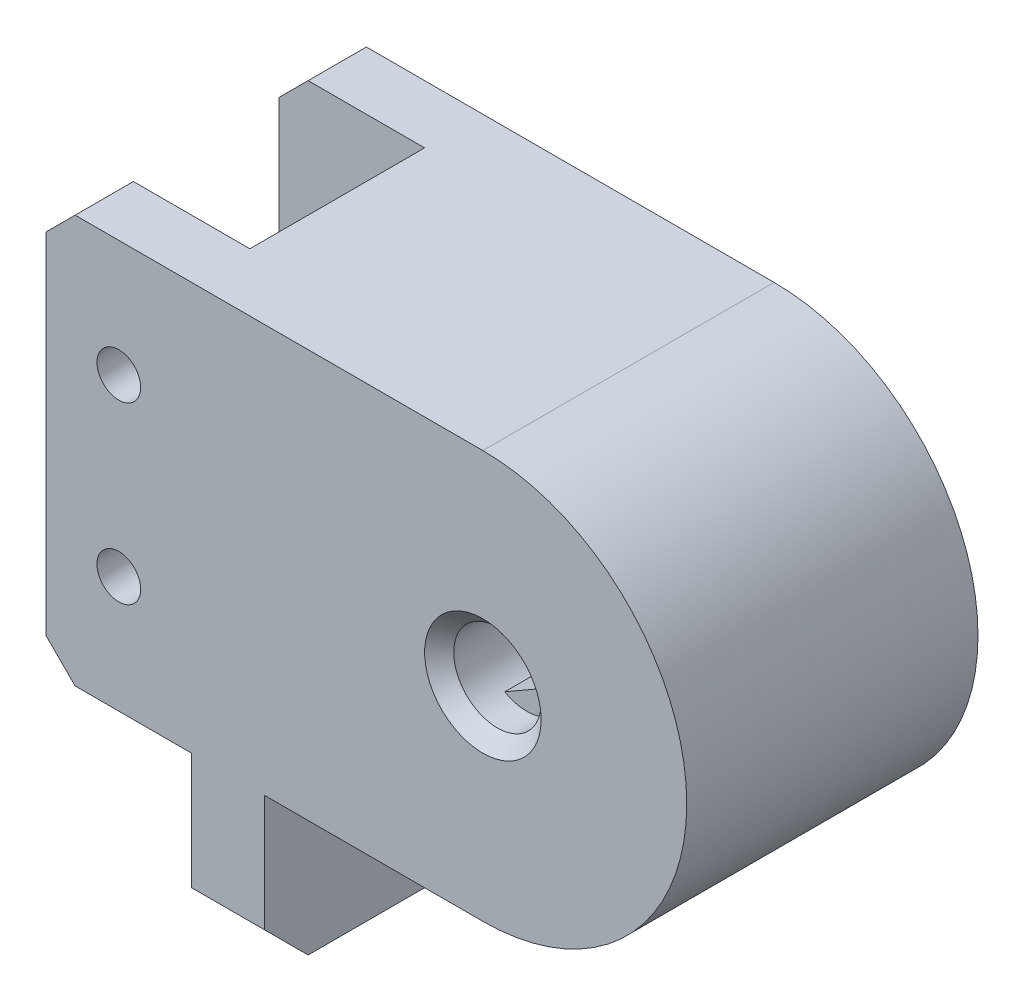
from build123d import *

# Parameters (mm, degrees)
EXTRUDE_1_DEPTH       = 20
CUT_EXTRUDE_1_DEPTH   = 39.678159
SKETCH_5_R            = 3
CUT_EXTRUDE_2_DEPTH   = 3
SKETCH_6_W            = 10
SKETCH_6_H            = 12
CUT_EXTRUDE_3_DEPTH   = 46.650849
F_3_0MM_1_D           = 3
F_3_0MM_1_CSINK_D     = 3.05
F_3_0MM_1_CSINK_ANGLE = 90
CHAMFER_2_SIZE        = 2
CUT_EXTRUDE_START     = -3
SKETCH_9_R            = 3
CUT_EXTRUDE_5_DEPTH   = 3
SKETCH_10_W           = 5
SKETCH_10_H           = 20
EXTRUDE_2_DEPTH       = 11
CHAMFER_3_SIZE        = 3
CHAMFER_4_SIZE        = 1


with BuildPart() as part:
    # 草图1 → 凸台-拉伸1 (new body)
    with BuildSketch(Plane.XY):
        with BuildLine():
            Line((0, 14), (-30, 14))
            Line((-30, 14), (-30, -14))
            Line((-30, -14), (0, -14))
            ThreePointArc((0, -14), (14, 0), (0, 14))
        make_face()
    extrude(amount=EXTRUDE_1_DEPTH)

    # 草图3 → 切除-拉伸1 (cut, through all)
    with BuildSketch(Plane(origin=(0, 0, 0), x_dir=(-1, 0, 0), z_dir=(0, 0, -1))):
        with BuildLine():
            Line((-3, 0), (1.5, -2.598076))
            ThreePointArc((1.5, -2.598076), (1.5, 2.598076), (-3, 0))
        make_face()
    extrude(amount=-CUT_EXTRUDE_1_DEPTH, mode=Mode.SUBTRACT)

    # 草图5 → 切除-拉伸2 (cut)
    with BuildSketch(Plane(origin=(0, 0, 0), x_dir=(-1, 0, 0), z_dir=(0, 0, -1))):
        Circle(SKETCH_5_R)
    extrude(amount=-CUT_EXTRUDE_2_DEPTH, mode=Mode.SUBTRACT)

    # 草图6 → 切除-拉伸3 (cut, through all)
    with BuildSketch(Plane.XZ.offset(14)):
        with Locations((-25, 10)):
            Rectangle(SKETCH_6_W, SKETCH_6_H)
    extrude(amount=-CUT_EXTRUDE_3_DEPTH, mode=Mode.SUBTRACT)

    # Ø3.0mm 暗销孔1 (through all)
    with Locations(Plane(origin=(-25, 6, 0), x_dir=(-1, 0, 0), z_dir=(0, 0, -1))):
        with Locations((0, 0), (0, -12)):
            CounterSinkHole(F_3_0MM_1_D / 2, F_3_0MM_1_CSINK_D / 2, counter_sink_angle=F_3_0MM_1_CSINK_ANGLE)

    # 倒角2
    chamfer_2_edges = [part.edges().sort_by_distance(p)[0] for p in [
        (-30, -14, 2),
        (-30, 14, 2),
        (-30, -14, 18),
        (-30, 14, 18),
    ]]
    chamfer(chamfer_2_edges, length=CHAMFER_2_SIZE)

    # 草图9 → 切除-拉伸5 (cut)
    with BuildSketch(Plane.XY.offset(20).offset(CUT_EXTRUDE_START)):
        with Locations(Location((0, 0, 0), (0, 0, 180))):
            Circle(SKETCH_9_R)
    extrude(amount=CUT_EXTRUDE_5_DEPTH, mode=Mode.SUBTRACT)

    # 草图10 → 凸台-拉伸2 (add)
    with BuildSketch(Plane.XZ.offset(14)):
        with Locations((-17.5, 10)):
            Rectangle(SKETCH_10_W, SKETCH_10_H)
    extrude(amount=EXTRUDE_2_DEPTH)

    # 倒角3
    chamfer_3_edges = [part.edges().sort_by_distance(p)[0] for p in [
        (-17.5, -25, 0),
        (-17.5, -25, 20),
    ]]
    chamfer(chamfer_3_edges, length=CHAMFER_3_SIZE)

    # 倒角4
    chamfer_4_edges = [part.edges().sort_by_distance(p)[0] for p in [
        (-2.598076, -1.5, 20),
        (1.5, 2.598076, 0),
    ]]
    chamfer(chamfer_4_edges, length=CHAMFER_4_SIZE)


solid = part.part
